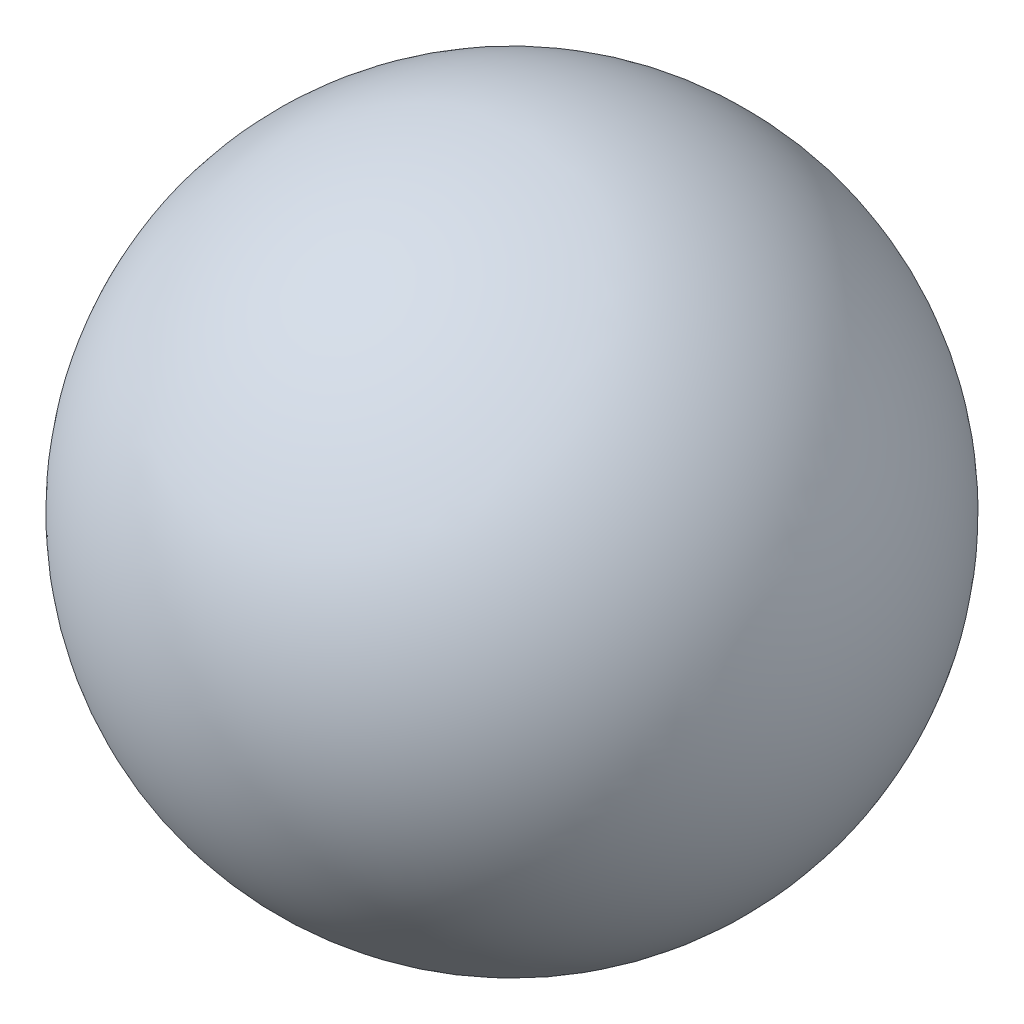
from build123d import *


with BuildPart() as part:
    # 草图2 → 旋转1 (revolve)
    with BuildSketch(Plane.XY):
        with BuildLine():
            Line((-0.794, 0), (0.794, 0))
            ThreePointArc((0.794, 0), (0, -0.794), (-0.794, 0))
        make_face()
    revolve(axis=Axis((-0.794, 0, 0), (1, 0, 0)))


solid = part.part
